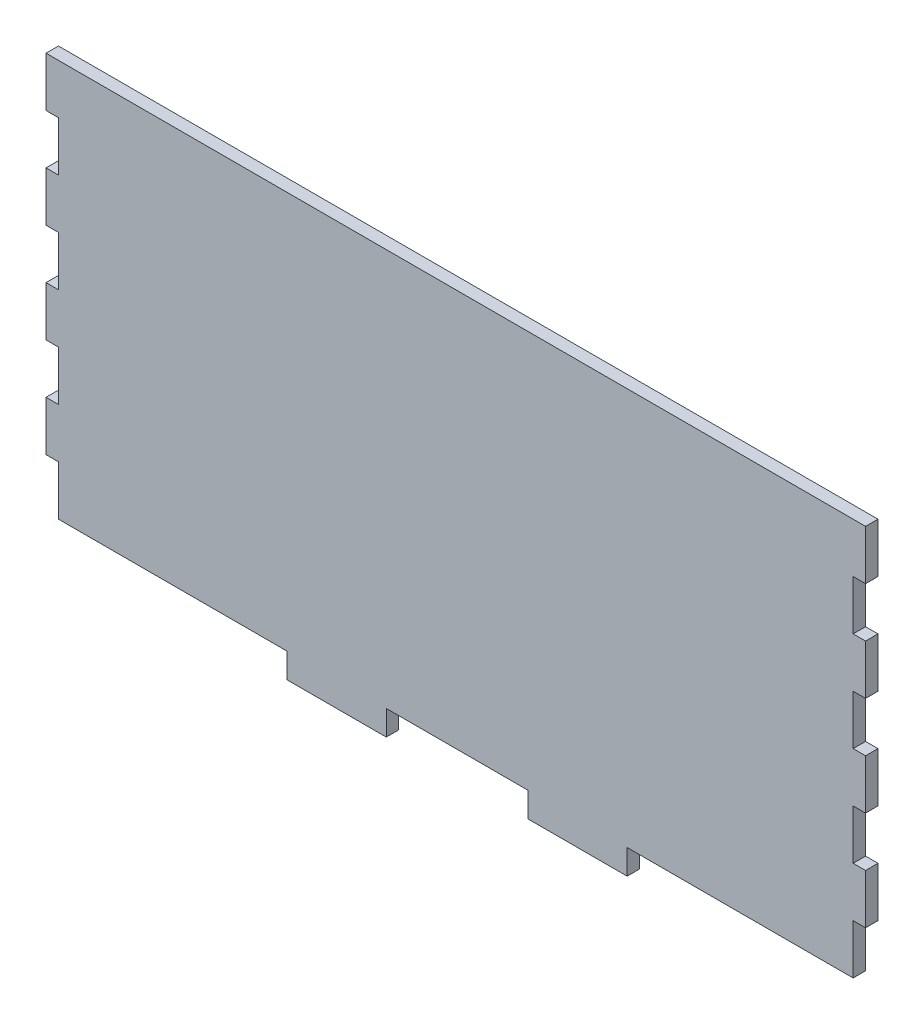
from build123d import *

# Parameters (mm, degrees)
SKETCH1_W           = 203.2
SKETCH1_H           = 101.6
BOSS_EXTRUDE1_DEPTH = 3.175
SKETCH2_W           = 3.175
SKETCH2_H           = 12.7
SKETCH2_W_2         = 25.4
SKETCH2_H_2         = 6.35
BOSS_EXTRUDE2_DEPTH = 3.175
SKETCH3_W           = 25.4
SKETCH3_H           = 6.35
CUT_EXTRUDE1_DEPTH  = 120.947785411


with BuildPart() as part:
    # Sketch1 → Boss-Extrude1 (new body)
    with BuildSketch(Plane.XY):
        Rectangle(SKETCH1_W, SKETCH1_H)
    extrude(amount=BOSS_EXTRUDE1_DEPTH)

    # Sketch2 → Boss-Extrude2 (add)
    with BuildSketch(Plane.XY.offset(3.175)):
        with Locations((-103.1875, 19.05)):
            Rectangle(SKETCH2_W, SKETCH2_H)
        with Locations((-103.1875, 44.45)):
            Rectangle(SKETCH2_W, SKETCH2_H)
        with Locations((-103.1875, -6.35)):
            Rectangle(SKETCH2_W, SKETCH2_H)
        with Locations((-103.1875, -31.75)):
            Rectangle(SKETCH2_W, SKETCH2_H)
        with Locations((-92.075, -53.975)):
            Rectangle(SKETCH2_W_2, SKETCH2_H_2)
        with Locations((-30.48, -53.975)):
            Rectangle(SKETCH2_W_2, SKETCH2_H_2)
        with Locations((31.115, -53.975)):
            Rectangle(SKETCH2_W_2, SKETCH2_H_2)
        with Locations((92.71, -53.975)):
            Rectangle(SKETCH2_W_2, SKETCH2_H_2)
        with Locations((103.1875, -31.75)):
            Rectangle(SKETCH2_W, SKETCH2_H)
        with Locations((103.1875, -6.35)):
            Rectangle(SKETCH2_W, SKETCH2_H)
        with Locations((103.1875, 19.05)):
            Rectangle(SKETCH2_W, SKETCH2_H)
        with Locations((103.1875, 44.45)):
            Rectangle(SKETCH2_W, SKETCH2_H)
    extrude(amount=-BOSS_EXTRUDE2_DEPTH)

    # Sketch3 → Cut-Extrude1 (cut, through all)
    with BuildSketch(Plane.XY.offset(3.175)):
        with Locations((-92.075, -53.975)):
            Rectangle(SKETCH3_W, SKETCH3_H)
        with Locations((92.71, -53.975)):
            Rectangle(SKETCH3_W, SKETCH3_H)
    extrude(amount=-CUT_EXTRUDE1_DEPTH, mode=Mode.SUBTRACT)


solid = part.part
